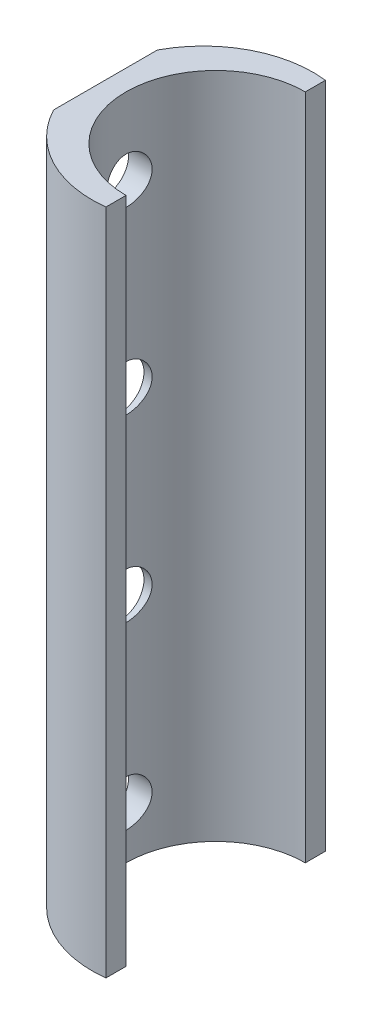
from build123d import *

# Parameters (mm, degrees)
BOSS_EXTRUDE1_DEPTH     = 20.2
BOSS_EXTRUDE3_DEPTH     = 130
SKETCH7_R               = 4.5
CUT_EXTRUDE1_DEPTH      = 10
CUT_EXTRUDE2_DEPTH      = 119.099419302
CUT_EXTRUDE2_DEPTH_BACK = 119.099419302
SKETCH8_W               = 3
SKETCH8_H               = 58.2


with BuildPart() as part:
    # Sketch1 → Boss-Extrude1 (new body)
    with BuildSketch(Plane.XY):
        Polygon((-76.580441788, 84.160209426), (-76.580441788, 48.260209426), (-73.580441788, 48.260209426), (-73.580441788, -9.939790574), (-76.580441788, -9.939790574), (-76.580441788, -45.839790574), (-72.580441788, -45.839790574), (-72.580441788, 84.160209426), align=None)
    extrude(amount=BOSS_EXTRUDE1_DEPTH)

    # Sketch2 → Boss-Extrude3 (add)
    with BuildSketch(Plane(origin=(0, 84.160209426, 0), x_dir=(1, 0, 0), z_dir=(0, 1, 0))):
        with BuildLine():
            Line((-72.580441788, -20.2), (-76.580441788, -20.2))
            ThreePointArc((-76.580441788, -20.2), (-67.602885827, -29.171952003), (-55.120441788, -31.47))
            Line((-55.120441788, -31.47), (-55.120441788, -27.56))
            ThreePointArc((-55.120441788, -27.56), (-63.136226216, -25.611247532), (-69.362688802, -20.2))
            Line((-69.362688802, -20.2), (-72.580441788, -20.2))
        make_face()
        with BuildLine():
            Line((-76.580441788, 0), (-72.580441788, 0))
            Line((-72.580441788, 0), (-69.362688802, 0))
            ThreePointArc((-69.362688802, 0), (-63.136226216, 5.411247532), (-55.120441788, 7.36))
            Line((-55.120441788, 7.36), (-55.120441788, 11.27))
            ThreePointArc((-55.120441788, 11.27), (-67.602885827, 8.971952003), (-76.580441788, 0))
        make_face()
        with BuildLine():
            Line((-69.362688802, 0), (-72.580441788, 0))
            Line((-72.580441788, 0), (-72.580441788, -10.1))
            ThreePointArc((-72.580441788, -10.1), (-71.756565628, -4.799907211), (-69.362688802, 0))
        make_face()
        with BuildLine():
            ThreePointArc((-69.362688802, -20.2), (-71.756565628, -15.400092789), (-72.580441788, -10.1))
            Line((-72.580441788, -10.1), (-72.580441788, -20.2))
            Line((-72.580441788, -20.2), (-69.362688802, -20.2))
        make_face()
    extrude(amount=-BOSS_EXTRUDE3_DEPTH)

    # Sketch7 → Cut-Extrude1 (cut)
    with BuildSketch(Plane.ZY.offset(76.580441788)):
        with Locations(Location((10.1, 69.160209426, 0), (0, 0, 270))):
            Circle(SKETCH7_R)
        with Locations(Location((10.1, 34.160209426, 0), (0, 0, 270))):
            Circle(SKETCH7_R)
        with Locations(Location((10.1, -0.839790574, 0), (0, 0, 270))):
            Circle(SKETCH7_R)
        with Locations(Location((10.1, -35.839790574, 0), (0, 0, 270))):
            Circle(SKETCH7_R)
    extrude(amount=-CUT_EXTRUDE1_DEPTH, mode=Mode.SUBTRACT)

    # Sketch8 → Cut-Extrude2 (cut, two sides: drawn at the far end of the back side and taken through both)
    with BuildSketch(Plane.XY.offset(-CUT_EXTRUDE2_DEPTH_BACK)):
        with Locations((-75.080441788, 19.160209426)):
            Rectangle(SKETCH8_W, SKETCH8_H)
    extrude(amount=CUT_EXTRUDE2_DEPTH + CUT_EXTRUDE2_DEPTH_BACK, mode=Mode.SUBTRACT)


solid = part.part
